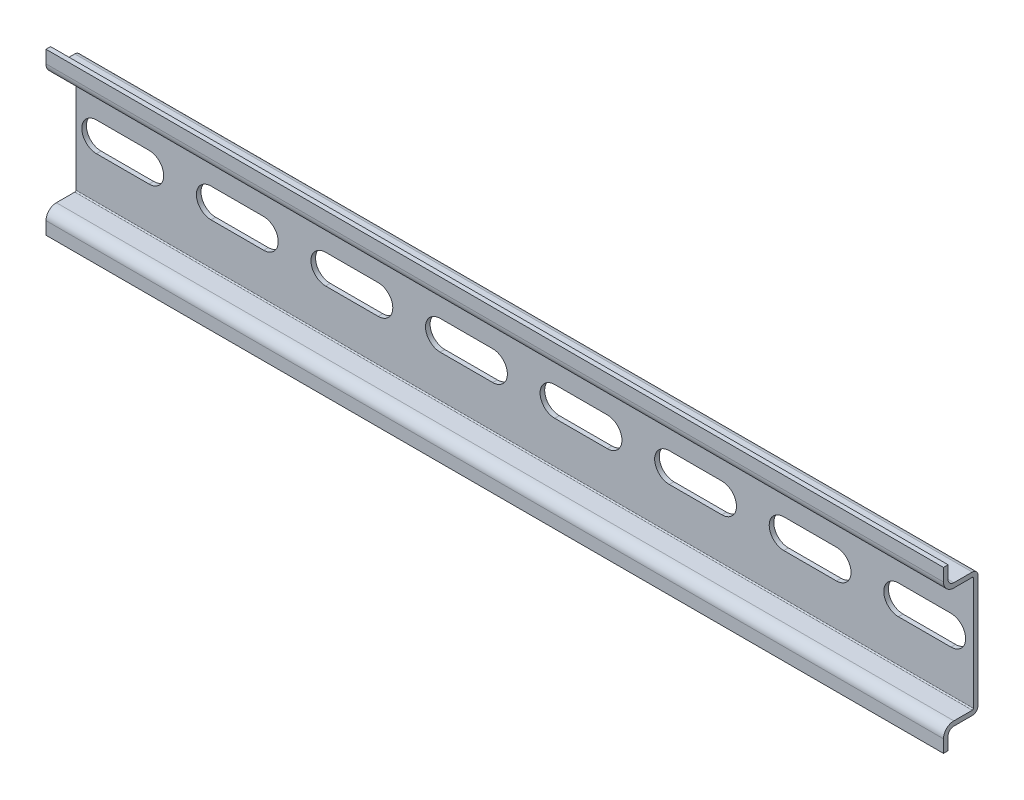
from build123d import *

# Parameters (mm, degrees)
STRUCTURAL_MEMBER1_DEPTH = 500
CUT_EXTRUDE1_REACH       = 252.724
LPATTERN1_COUNT          = 196
LPATTERN1_PITCH          = 24.892
SKETCH4_W                = 4000
SKETCH4_H                = 182.847095399
CUT_EXTRUDE2_DEPTH       = 140
SKETCH5_W                = 3.509513676
SKETCH5_H                = 55.564681105
CUT_EXTRUDE3_DEPTH       = 140


with BuildPart() as part:
    # Sketch2 → Structural Member1 (new body)
    with BuildSketch(Plane(origin=(-250, 0, 0), x_dir=(0, 0, -1), z_dir=(1, 0, 0))):
        with BuildLine():
            Line((0, 12.25), (0, -12.25))
            ThreePointArc((0, -12.25), (-0.366116524, -13.133883476), (-1.25, -13.5))
            Line((-1.25, -13.5), (-5.25, -13.5))
            ThreePointArc((-5.25, -13.5), (-6.133883476, -13.866116524), (-6.5, -14.75))
            Line((-6.5, -14.75), (-6.5, -17.5))
            Line((-6.5, -17.5), (-7.5, -17.5))
            Line((-7.5, -17.5), (-7.5, -14.75))
            ThreePointArc((-7.5, -14.75), (-6.840990258, -13.159009742), (-5.25, -12.5))
            Line((-5.25, -12.5), (-1.25, -12.5))
            ThreePointArc((-1.25, -12.5), (-1.073223305, -12.426776695), (-1, -12.25))
            Line((-1, -12.25), (-1, 12.25))
            ThreePointArc((-1, 12.25), (-1.073223305, 12.426776695), (-1.25, 12.5))
            Line((-1.25, 12.5), (-5.25, 12.5))
            ThreePointArc((-5.25, 12.5), (-6.840990258, 13.159009742), (-7.5, 14.75))
            Line((-7.5, 14.75), (-7.5, 17.5))
            Line((-7.5, 17.5), (-6.5, 17.5))
            Line((-6.5, 17.5), (-6.5, 14.75))
            ThreePointArc((-6.5, 14.75), (-6.133883476, 13.866116524), (-5.25, 13.5))
            Line((-5.25, 13.5), (-1.25, 13.5))
            ThreePointArc((-1.25, 13.5), (-0.366116524, 13.133883476), (0, 12.25))
        make_face()
    extrude(amount=STRUCTURAL_MEMBER1_DEPTH)

    # Sketch3 → Cut-Extrude1 (cut, up to next)
    with BuildSketch(Plane.XY, mode=Mode.PRIVATE) as cut_extrude1_sk1:
        with BuildLine():
            Line((-241.745, 3.175), (-230.315, 3.175))
            ThreePointArc((-230.315, 3.175), (-227.14, 0), (-230.315, -3.175))
            Line((-230.315, -3.175), (-241.745, -3.175))
            ThreePointArc((-241.745, -3.175), (-244.92, 0), (-241.745, 3.175))
        make_face()
    cut_extrude1_tool1 = extrude(cut_extrude1_sk1.sketch, amount=CUT_EXTRUDE1_REACH, mode=Mode.PRIVATE) & part.part
    cut_extrude1 = cut_extrude1_tool1.solids().sort_by_distance((-236.03, 0, 0))[0]
    add(cut_extrude1, mode=Mode.SUBTRACT)

    # LPattern1: Cut-Extrude1 ×196
    with Locations(*[(i * LPATTERN1_PITCH, 0, 0) for i in range(1, LPATTERN1_COUNT)]):
        add(cut_extrude1, mode=Mode.SUBTRACT)

    # Sketch4 → Cut-Extrude2 (cut)
    with BuildSketch(Plane.XY.offset(7.5)):
        with Locations((-1947.5, -12.909953422)):
            Rectangle(SKETCH4_W, SKETCH4_H)
    extrude(amount=-CUT_EXTRUDE2_DEPTH, mode=Mode.SUBTRACT)

    # Sketch5 → Cut-Extrude3 (cut)
    with BuildSketch(Plane.XY.offset(7.5)):
        with Locations((249.254756838, -3.17340083)):
            Rectangle(SKETCH5_W, SKETCH5_H)
    extrude(amount=-CUT_EXTRUDE3_DEPTH, mode=Mode.SUBTRACT)


solid = part.part
